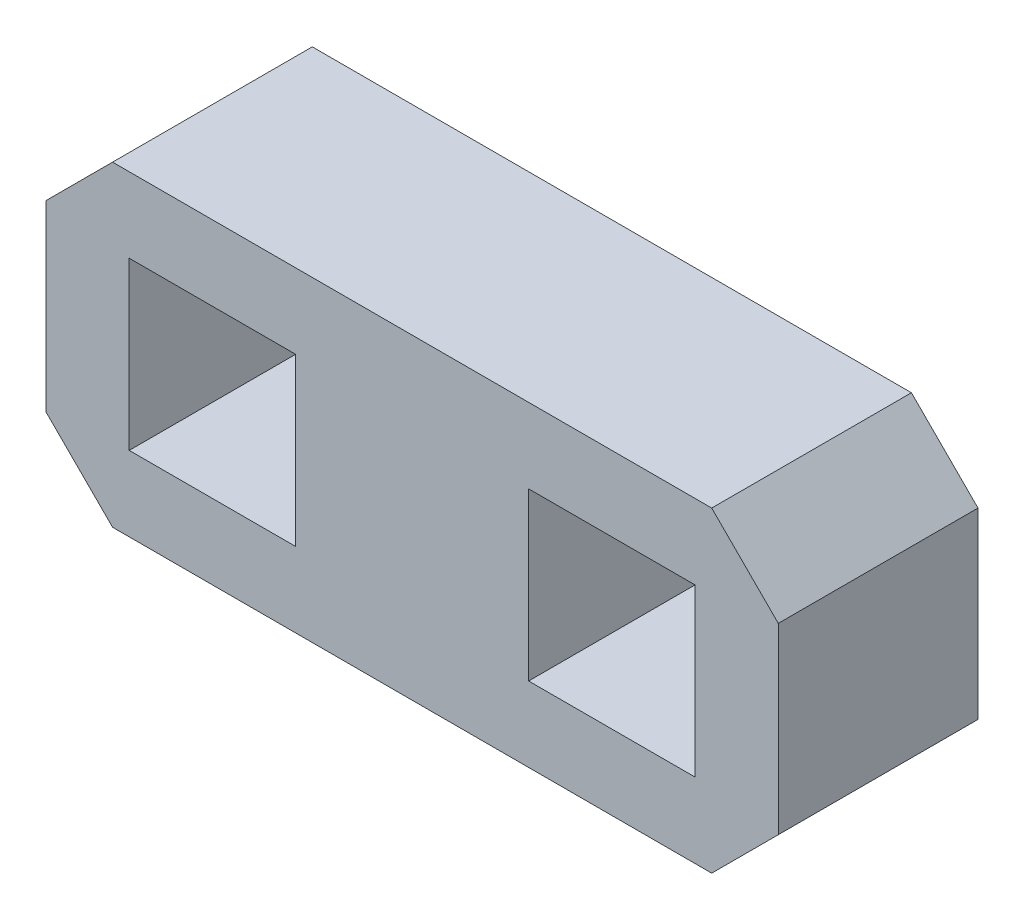
from build123d import *

# Parameters (mm, degrees)
SKETCH_1_W          = 22
SKETCH_1_H          = 9.5
EXTRUDE_1_DEPTH     = 3
SKETCH_2_W          = 5
SKETCH_2_H          = 5
CUT_EXTRUDE_1_DEPTH = 14.400093283
CHAMFER_1_SIZE      = 2


with BuildPart() as part:
    # 草图1 → 凸台-拉伸1 (new, symmetric)
    with BuildSketch(Plane.XY):
        Rectangle(SKETCH_1_W, SKETCH_1_H)
    extrude(amount=EXTRUDE_1_DEPTH, both=True)

    # 草图2 → 切除-拉伸1 (cut, through all)
    with BuildSketch(Plane.XY.offset(3)):
        with Locations((6, 0)):
            Rectangle(SKETCH_2_W, SKETCH_2_H)
    cut_extrude_1 = extrude(amount=-CUT_EXTRUDE_1_DEPTH, mode=Mode.SUBTRACT)

    # 镜向1: 切除-拉伸1 across plane
    add(cut_extrude_1.mirror(Plane(origin=(0, 0, 0), x_dir=(0, 0, 1), z_dir=(1, 0, 0))), mode=Mode.SUBTRACT)

    # 倒角1
    chamfer_1_edges = [part.edges().sort_by_distance(p)[0] for p in [
        (11, -4.75, 0),
        (-11, -4.75, 0),
        (-11, 4.75, 0),
        (11, 4.75, 0),
    ]]
    chamfer(chamfer_1_edges, length=CHAMFER_1_SIZE)


solid = part.part
